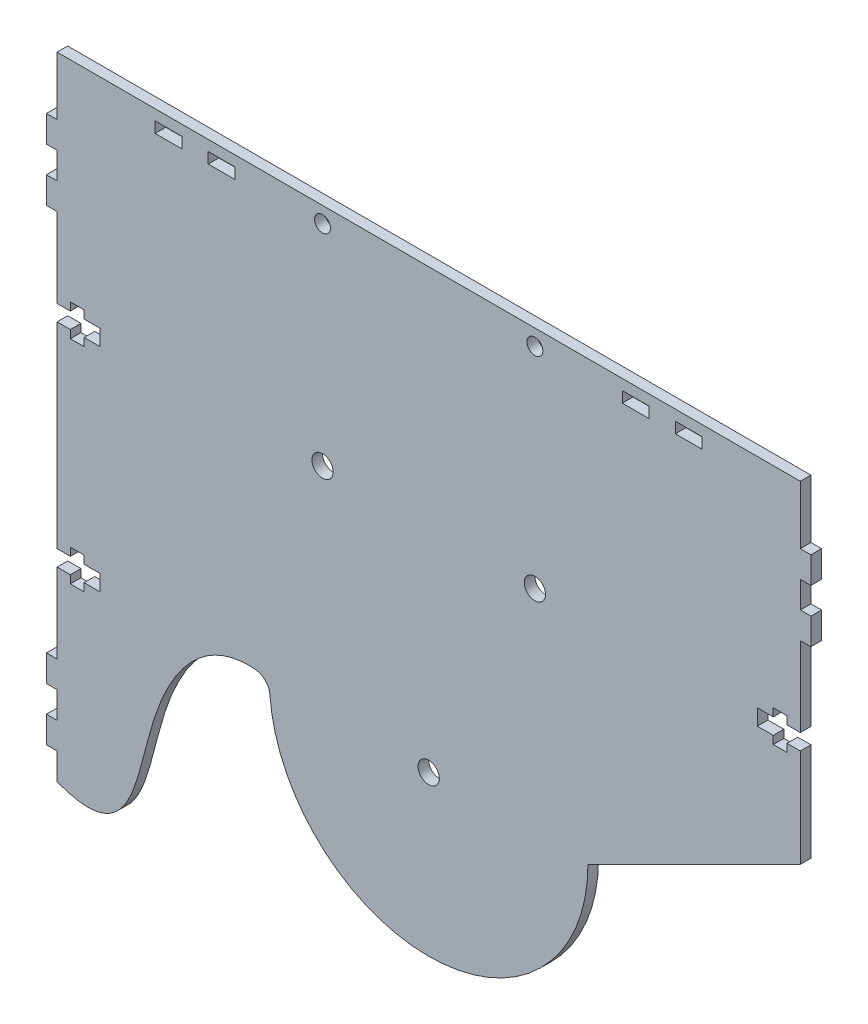
from build123d import *

# Parameters (mm, degrees)
SKETCH_1_R      = 2
SKETCH_1_R_2    = 1.5
SKETCH_1_W      = 5.05
SKETCH_1_H      = 2.05
EXTRUDE_1_DEPTH = 2


with BuildPart() as part:
    # 草图1 → 凸台-拉伸1 (new body)
    with BuildSketch(Plane.XY):
        with BuildLine():
            Line((317.453360513, 294.462931603), (319.953360513, 294.462931603))
            Line((319.953360513, 294.462931603), (319.953360513, 275.962931603))
            Line((319.953360513, 275.962931603), (279.953360513, 255.962931603))
            ThreePointArc((279.953360513, 255.962931603), (251.095061372, 225.984664155), (220.040259237, 253.681184024))
            ThreePointArc((220.040259237, 253.681184024), (219.19036683, 255.554039999), (217.334030317, 256.439433332))
            add(Edge.make_bspline(
                [(217.334030317, 256.439433332), (215.548727104, 256.609856683), (206.547632182, 255.661407624), (194.456958912, 237.242452466), (194.688078584, 213.970775709), (179.953360513, 219.413055772)],
                knots=[0.04025352, 0.04025352, 0.04025352, 0.04025352, 0.124939279, 0.47725999, 1, 1, 1, 1], degree=3))
            Line((179.953360513, 219.413055772), (179.953360513, 224.462931603))
            Line((179.953360513, 224.462931603), (177.953360513, 224.462931603))
            Line((177.953360513, 224.462931603), (177.953360513, 229.462931603))
            Line((177.953360513, 229.462931603), (179.953360513, 229.462931603))
            Line((179.953360513, 229.462931603), (179.953360513, 234.462931603))
            Line((179.953360513, 234.462931603), (177.953360513, 234.462931603))
            Line((177.953360513, 234.462931603), (177.953360513, 239.462931603))
            Line((177.953360513, 239.462931603), (179.953360513, 239.462931603))
            Line((179.953360513, 239.462931603), (179.953360513, 254.462931603))
            Line((179.953360513, 254.462931603), (182.453360513, 254.462931603))
            Line((182.453360513, 254.462931603), (182.453360513, 252.962931602))
            Line((182.453360513, 252.962931602), (185.053360513, 252.962931602))
            Line((185.053360513, 252.962931602), (185.053360513, 254.462931603))
            Line((185.053360513, 254.462931603), (188.053360513, 254.462931603))
            Line((188.053360513, 254.462931603), (188.053360513, 257.462931602))
            Line((188.053360513, 257.462931602), (185.053360513, 257.462931602))
            Line((185.053360513, 257.462931602), (185.053360513, 258.962931602))
            Line((185.053360513, 258.962931602), (182.453360513, 258.962931602))
            Line((182.453360513, 258.962931602), (182.453360513, 257.462931603))
            Line((182.453360513, 257.462931603), (179.953360513, 257.462931603))
            Line((179.953360513, 257.462931603), (179.953360513, 294.462931603))
            Line((179.953360513, 294.462931603), (182.453360513, 294.462931603))
            Line((182.453360513, 294.462931603), (182.453360513, 292.962931603))
            Line((182.453360513, 292.962931603), (185.053360513, 292.962931603))
            Line((185.053360513, 292.962931603), (185.053360513, 294.462931603))
            Line((185.053360513, 294.462931603), (188.053360513, 294.462931603))
            Line((188.053360513, 294.462931603), (188.053360513, 297.462931603))
            Line((188.053360513, 297.462931603), (185.053360513, 297.462931603))
            Line((185.053360513, 297.462931603), (185.053360513, 298.962931603))
            Line((185.053360513, 298.962931603), (182.453360513, 298.962931603))
            Line((182.453360513, 298.962931603), (182.453360513, 297.462931603))
            Line((182.453360513, 297.462931603), (179.953360513, 297.462931603))
            Line((179.953360513, 297.462931603), (179.953360513, 312.462931603))
            Line((179.953360513, 312.462931603), (177.953360513, 312.462931603))
            Line((177.953360513, 312.462931603), (177.953360513, 317.462931603))
            Line((177.953360513, 317.462931603), (179.953360513, 317.462931603))
            Line((179.953360513, 317.462931603), (179.953360513, 322.462931603))
            Line((179.953360513, 322.462931603), (177.953360513, 322.462931603))
            Line((177.953360513, 322.462931603), (177.953360513, 327.462931603))
            Line((177.953360513, 327.462931603), (179.953360513, 327.462931603))
            Line((179.953360513, 327.462931603), (179.953360513, 338.462931603))
            Line((179.953360513, 338.462931603), (319.953360513, 338.462931603))
            Line((319.953360513, 338.462931603), (319.953360513, 327.462931603))
            Line((319.953360513, 327.462931603), (321.953360513, 327.462931603))
            Line((321.953360513, 327.462931603), (321.953360513, 322.462931603))
            Line((321.953360513, 322.462931603), (319.953360513, 322.462931603))
            Line((319.953360513, 322.462931603), (319.953360513, 317.462931603))
            Line((319.953360513, 317.462931603), (321.953360513, 317.462931603))
            Line((321.953360513, 317.462931603), (321.953360513, 312.462931603))
            Line((321.953360513, 312.462931603), (319.953360513, 312.462931603))
            Line((319.953360513, 312.462931603), (319.953360513, 297.462931603))
            Line((319.953360513, 297.462931603), (317.453360513, 297.462931603))
            Line((317.453360513, 297.462931603), (317.453360513, 298.962931603))
            Line((317.453360513, 298.962931603), (314.853360513, 298.962931603))
            Line((314.853360513, 298.962931603), (314.853360513, 297.462931603))
            Line((314.853360513, 297.462931603), (311.853360513, 297.462931603))
            Line((311.853360513, 297.462931603), (311.853360513, 294.462931603))
            Line((311.853360513, 294.462931603), (314.853360513, 294.462931603))
            Line((314.853360513, 294.462931603), (314.853360513, 292.962931603))
            Line((314.853360513, 292.962931603), (317.453360513, 292.962931603))
            Line((317.453360513, 292.962931603), (317.453360513, 294.462931603))
        make_face()
        with Locations((249.953360513, 255.962931603)):
            Circle(SKETCH_1_R, mode=Mode.SUBTRACT)
        with Locations((229.953360513, 335.462931603)):
            Circle(SKETCH_1_R_2, mode=Mode.SUBTRACT)
        with Locations((269.953360513, 335.462931603)):
            Circle(SKETCH_1_R_2, mode=Mode.SUBTRACT)
        with Locations((229.953360513, 295.962931603)):
            Circle(SKETCH_1_R, mode=Mode.SUBTRACT)
        with Locations((269.953360513, 295.962931603)):
            Circle(SKETCH_1_R, mode=Mode.SUBTRACT)
        with Locations((288.953360513, 335.462931603)):
            Rectangle(SKETCH_1_W, SKETCH_1_H, mode=Mode.SUBTRACT)
        with Locations((298.953360513, 335.462931603)):
            Rectangle(SKETCH_1_W, SKETCH_1_H, mode=Mode.SUBTRACT)
        with Locations((200.953360513, 335.462931603)):
            Rectangle(SKETCH_1_W, SKETCH_1_H, mode=Mode.SUBTRACT)
        with Locations((210.953360513, 335.462931603)):
            Rectangle(SKETCH_1_W, SKETCH_1_H, mode=Mode.SUBTRACT)
    extrude(amount=EXTRUDE_1_DEPTH)


solid = part.part
